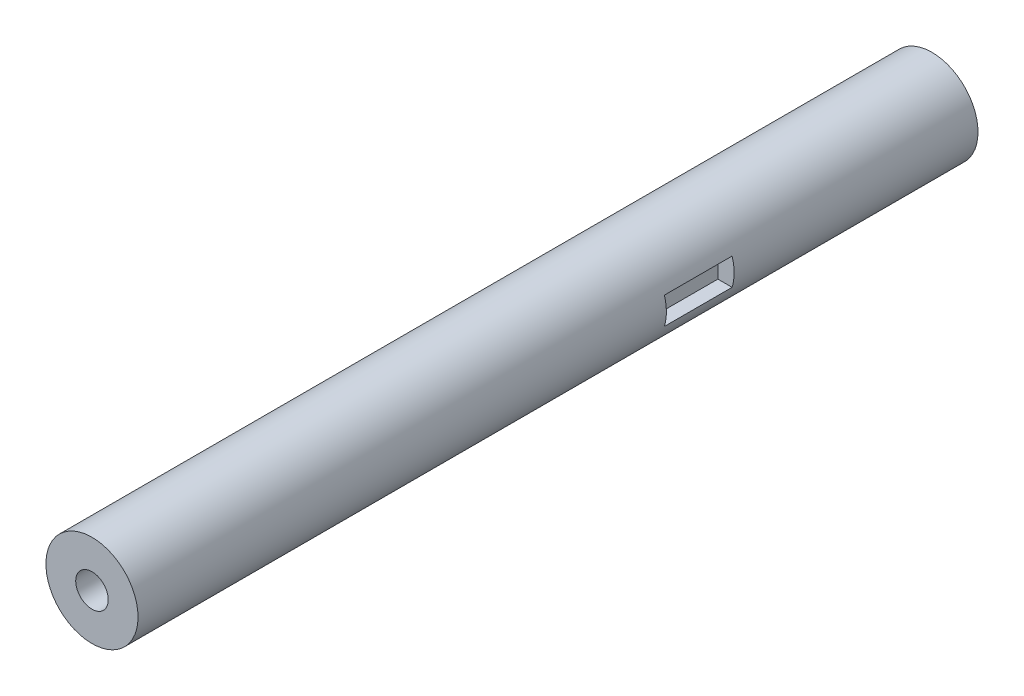
from build123d import *

# Parameters (mm, degrees)
AXLE_ENVELOPE_START = -75
SKETCH_1_R          = 8.5
SKETCH_1_R_2        = 3
AXLE_ENVELOPE_DEPTH = 155
AXLE_KEYWAY_START   = -30
SKETCH_2_W          = 5
SKETCH_2_H          = 5
AXLE_KEYWAY_DEPTH   = 12.5


with BuildPart() as part:
    # Эскиз1 → Axle_envelope (new body)
    with BuildSketch(Plane.XY.offset(AXLE_ENVELOPE_START)):
        Circle(SKETCH_1_R)
        Circle(SKETCH_1_R_2, mode=Mode.SUBTRACT)
    extrude(amount=AXLE_ENVELOPE_DEPTH)

    # Эскиз2 → Axle_keyway (cut)
    with BuildSketch(Plane.XY.offset(AXLE_KEYWAY_START)):
        with Locations((8, 0)):
            Rectangle(SKETCH_2_W, SKETCH_2_H)
    extrude(amount=AXLE_KEYWAY_DEPTH, mode=Mode.SUBTRACT)


solid = part.part
